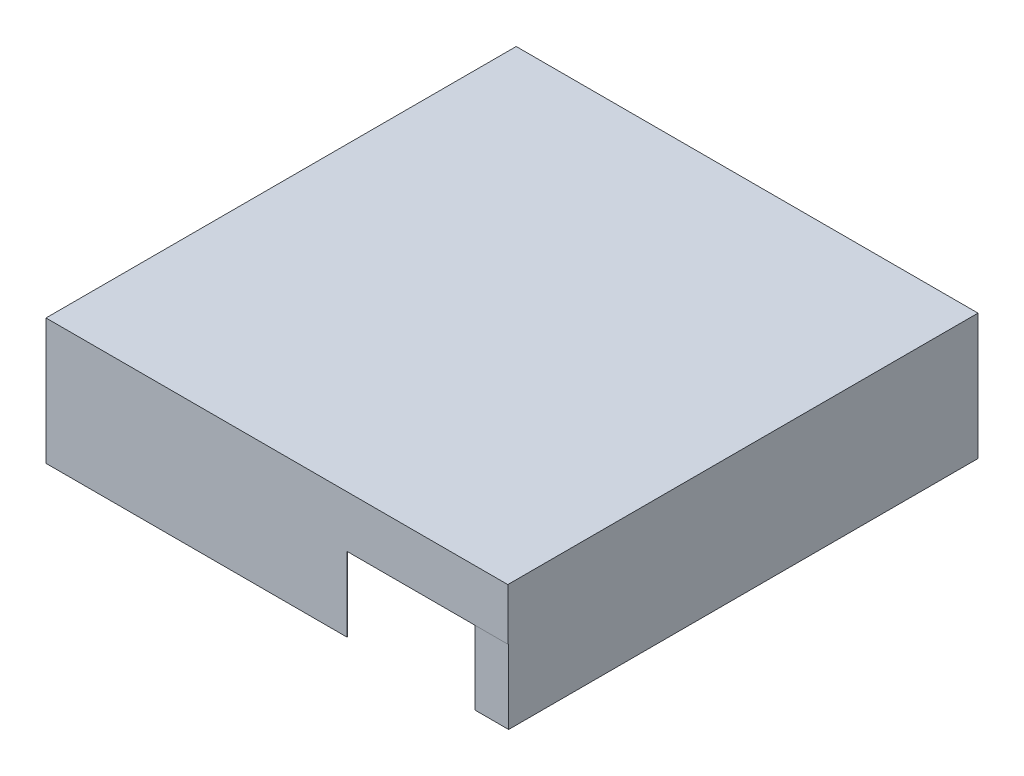
from build123d import *

# Parameters (mm, degrees)
SKETCH9_W           = 27.5
SKETCH9_H           = 28
BOSS_EXTRUDE2_DEPTH = 7.5
SKETCH10_W          = 23.5
SKETCH10_H          = 25.45
CUT_EXTRUDE1_DEPTH  = 6.1
SKETCH12_W          = 18.5
SKETCH12_H          = 12.3
CUT_EXTRUDE2_DEPTH  = 3
SKETCH11_W          = 9.585282086
SKETCH11_H          = 9.717675131
CUT_EXTRUDE3_DEPTH  = 5.05


with BuildPart() as part:
    # Sketch9 → Boss-Extrude2 (new, symmetric)
    with BuildSketch(Plane(origin=(0, 0, 0), x_dir=(1, 0, 0), z_dir=(0, 1, 0))):
        with Locations((0, 14)):
            Rectangle(SKETCH9_W, SKETCH9_H)
    extrude(amount=BOSS_EXTRUDE2_DEPTH, both=True)

    # Sketch10 → Cut-Extrude1 (cut, symmetric)
    with BuildSketch(Plane(origin=(0, 0, 0), x_dir=(1, 0, 0), z_dir=(0, 1, 0))):
        with Locations((0, 12.775)):
            Rectangle(SKETCH10_W, SKETCH10_H)
    extrude(amount=CUT_EXTRUDE1_DEPTH, both=True, mode=Mode.SUBTRACT)

    # Sketch12 → Cut-Extrude2 (cut)
    with BuildSketch(Plane.XY.offset(-28)):
        Rectangle(SKETCH12_W, SKETCH12_H)
    extrude(amount=CUT_EXTRUDE2_DEPTH, mode=Mode.SUBTRACT)

    # Sketch11 → Cut-Extrude3 (cut)
    with BuildSketch(Plane.XY.offset(5)):
        with Locations((8.957358957, -0.433824782)):
            Rectangle(SKETCH11_W, SKETCH11_H)
    extrude(amount=-CUT_EXTRUDE3_DEPTH, mode=Mode.SUBTRACT)


with BuildPart() as body_2:
    # Split1: the piece on the far side of the plane
    add(part.part)
    split(bisect_by=Plane.ZX, keep=Keep.BOTTOM)


with BuildPart() as part_1:
    add(part.part)

    # Split1
    split(bisect_by=Plane.ZX, keep=Keep.TOP)


solid = part_1.part
